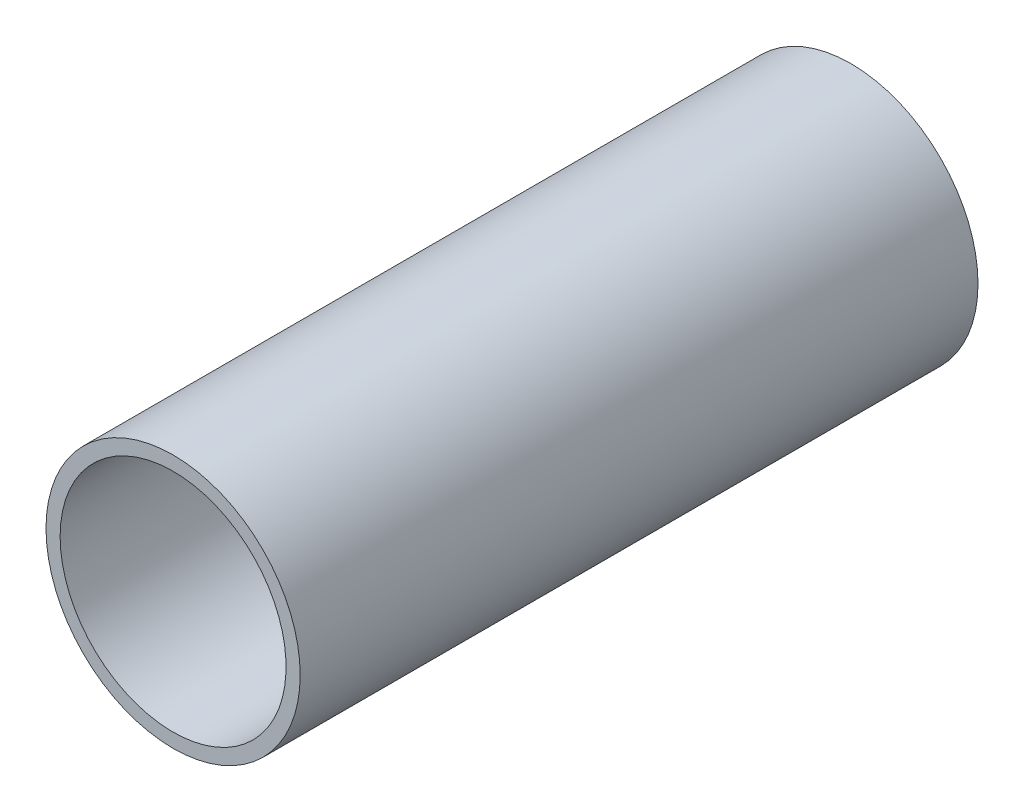
from build123d import *

# Parameters (mm, degrees)
SKETCH1_R           = 57.15
SKETCH1_R_2         = 50.8
BOSS_EXTRUDE1_DEPTH = 304.8


with BuildPart() as part:
    # Sketch1 → Boss-Extrude1 (new body)
    with BuildSketch(Plane.XY):
        with Locations(Location((0, 0, 0), (0, 0, 180))):
            Circle(SKETCH1_R)
        with Locations(Location((0, 0, 0), (0, 0, 180))):
            Circle(SKETCH1_R_2, mode=Mode.SUBTRACT)
    extrude(amount=BOSS_EXTRUDE1_DEPTH)


solid = part.part
